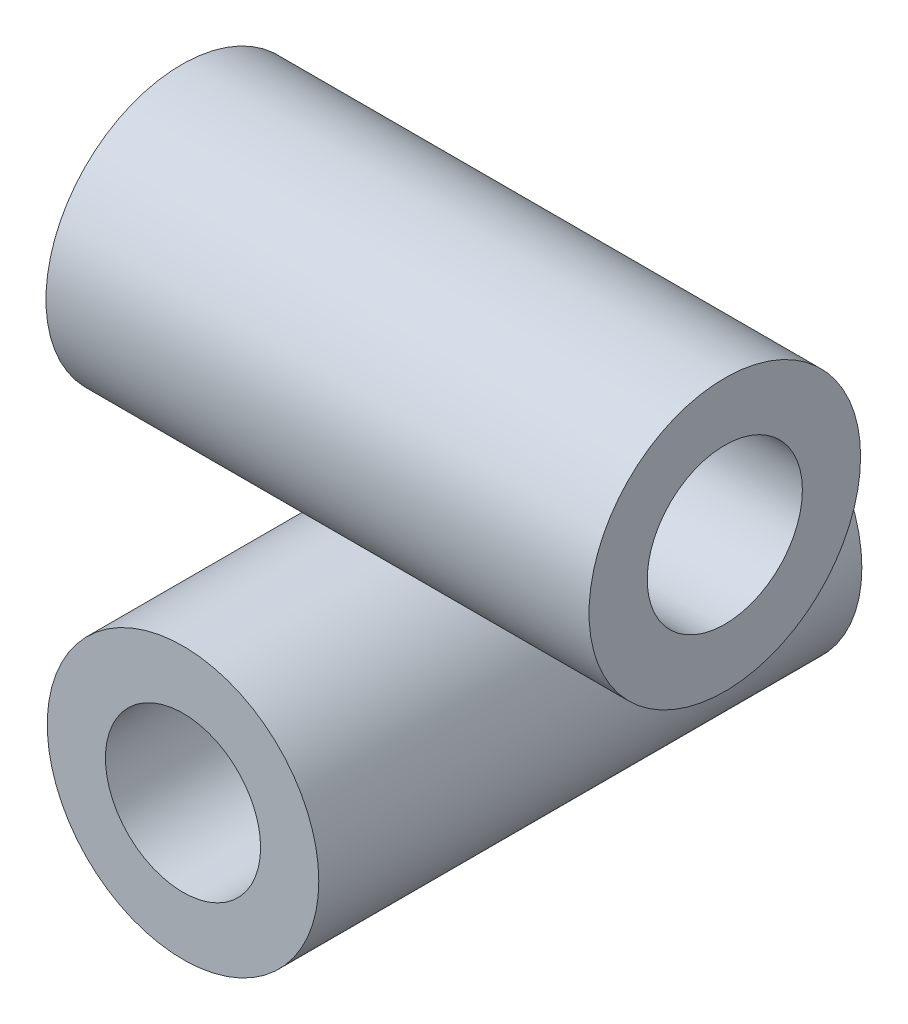
from build123d import *

# Parameters (mm, degrees)
SKETCH2_R           = 14
SKETCH2_R_2         = 8
BOSS_EXTRUDE1_DEPTH = 56
SKETCH4_R           = 14
SKETCH4_R_2         = 8
BOSS_EXTRUDE2_DEPTH = 28


with BuildPart() as part:
    # Sketch2 → Boss-Extrude1 (new body)
    with BuildSketch(Plane(origin=(0, 0, 0), x_dir=(0, 1, 0), z_dir=(0, 0, 1))):
        with Locations(Location((0, 0, 0), (0, 0, 270))):
            Circle(SKETCH2_R)
        with Locations(Location((0, 0, 0), (0, 0, 270))):
            Circle(SKETCH2_R_2, mode=Mode.SUBTRACT)
    extrude(amount=BOSS_EXTRUDE1_DEPTH)

    # Sketch4 → Boss-Extrude2 (add, symmetric)
    with BuildSketch(Plane.YZ):
        with Locations(Location((24, 28.13266563, 0), (0, 0, 270))):
            Circle(SKETCH4_R)
        with Locations(Location((24, 28.13266563, 0), (0, 0, 270))):
            Circle(SKETCH4_R_2, mode=Mode.SUBTRACT)
    extrude(amount=BOSS_EXTRUDE2_DEPTH, both=True)


solid = part.part
